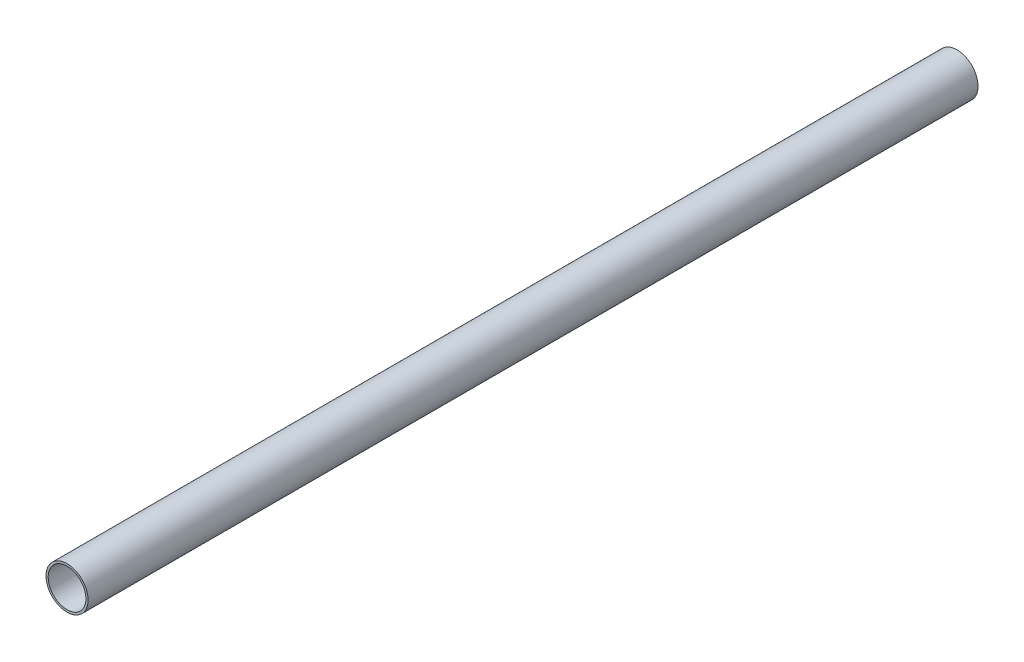
from build123d import *

# Parameters (mm, degrees)
SKETCH1_R           = 11.1125
SKETCH1_R_2         = 9.9695
BOSS_EXTRUDE1_DEPTH = 235


with BuildPart() as part:
    # Sketch1 → Boss-Extrude1 (new, symmetric)
    with BuildSketch(Plane.XY):
        with Locations(Location((0, 0, 0), (0, 0, 180))):
            Circle(SKETCH1_R)
        with Locations(Location((0, 0, 0), (0, 0, 180))):
            Circle(SKETCH1_R_2, mode=Mode.SUBTRACT)
    extrude(amount=BOSS_EXTRUDE1_DEPTH, both=True)


solid = part.part
